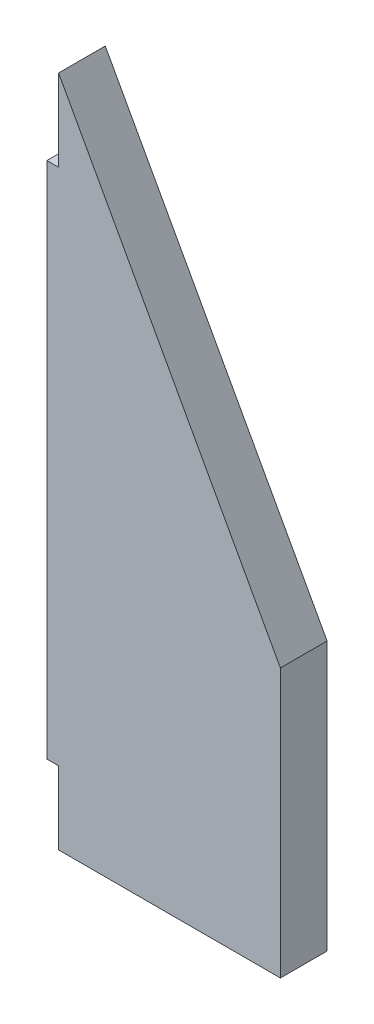
from build123d import *

# Parameters (mm, degrees)
BOSS_EXTRUDE1_DEPTH = 10.16


with BuildPart() as part:
    # Sketch1 → Boss-Extrude1 (new body)
    with BuildSketch(Plane.XY):
        Polygon((-2.328391652, 15.850315583), (0.211608348, 15.850315583), (0.211608348, 0), (48.471608348, 0), (48.471608348, 58.42), (0.211608348, 146.39148807), (0.211608348, 128.626315583), (-2.328391652, 128.626315583), align=None)
    extrude(amount=BOSS_EXTRUDE1_DEPTH)


solid = part.part
